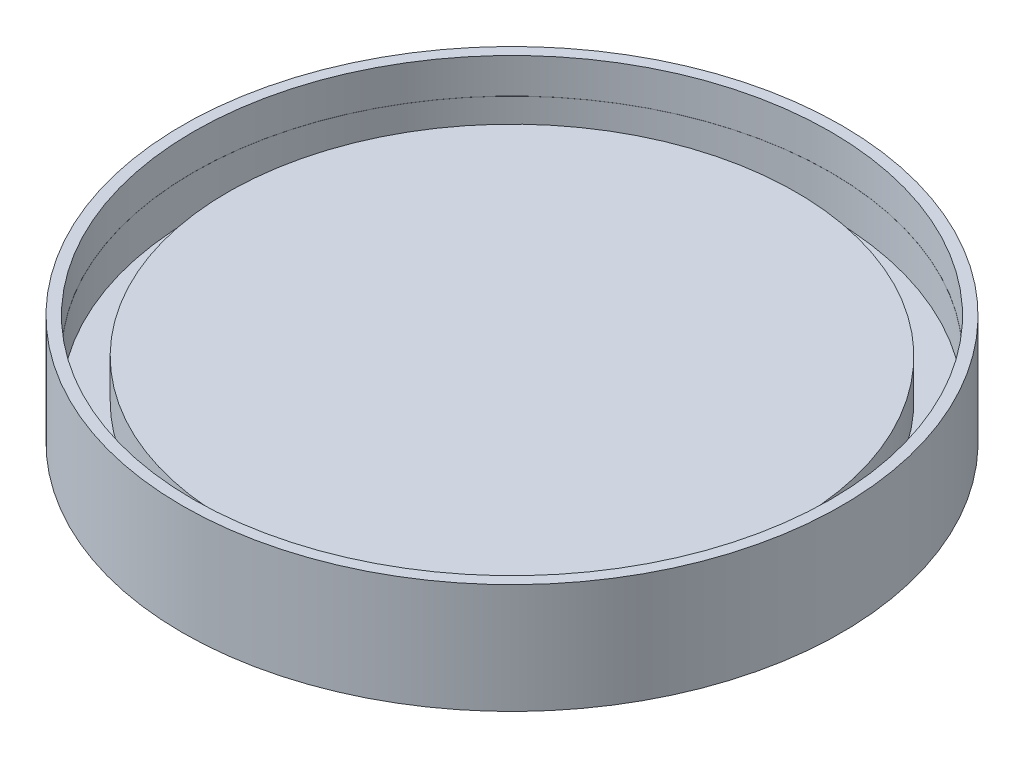
from build123d import *

# Parameters (mm, degrees)
SKETCH1_R           = 45
BOSS_EXTRUDE1_DEPTH = 15
SKETCH2_R           = 43.5
CUT_EXTRUDE1_DEPTH  = 4.8
SKETCH3_R           = 43.487927738
SKETCH3_R_2         = 38.8
CUT_EXTRUDE2_DEPTH  = 5.4


with BuildPart() as part:
    # Sketch1 → Boss-Extrude1 (new body)
    with BuildSketch(Plane(origin=(0, 0, 0), x_dir=(1, 0, 0), z_dir=(0, 1, 0))):
        with Locations(Location((0, 0, 0), (0, 0, 270))):
            Circle(SKETCH1_R)
    extrude(amount=BOSS_EXTRUDE1_DEPTH)

    # Sketch2 → Cut-Extrude1 (cut)
    with BuildSketch(Plane(origin=(0, 15, 0), x_dir=(1, 0, 0), z_dir=(0, 1, 0))):
        with Locations(Location((0, 0, 0), (0, 0, 270))):
            Circle(SKETCH2_R)
    extrude(amount=-CUT_EXTRUDE1_DEPTH, mode=Mode.SUBTRACT)

    # Sketch3 → Cut-Extrude2 (cut)
    with BuildSketch(Plane(origin=(0, 10.2, 0), x_dir=(1, 0, 0), z_dir=(0, 1, 0))):
        with Locations(Location((0, 0, 0), (0, 0, 270))):
            Circle(SKETCH3_R)
        with Locations(Location((0, 0, 0), (0, 0, 270))):
            Circle(SKETCH3_R_2, mode=Mode.SUBTRACT)
    extrude(amount=-CUT_EXTRUDE2_DEPTH, mode=Mode.SUBTRACT)


solid = part.part
